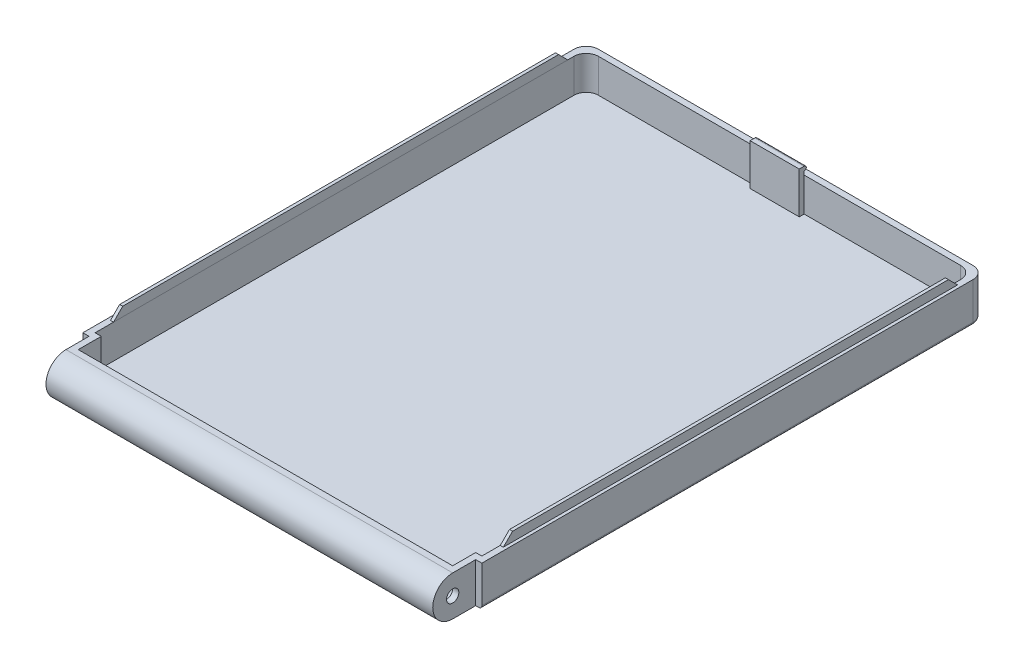
from build123d import *

# Parameters (mm, degrees)
SALIENTE_EXTRUIR1_DEPTH     = 13
CORTAR_EXTRUIR7_DEPTH       = 11
CORTAR_EXTRUIR9_DEPTH       = 140
CROQUIS10_R                 = 4.5
CORTAR_EXTRUIR10_DEPTH      = 122
CROQUIS11_W                 = 122
CROQUIS11_H                 = 12.524990812
CORTAR_EXTRUIR12_DEPTH      = 11
CORTAR_EXTRUIR13_DEPTH      = 130
CORTAR_EXTRUIR13_DEPTH_BACK = 130
CROQUIS12_R                 = 2
CROQUIS13_W                 = 16
CROQUIS13_H                 = 13.5
SALIENTE_EXTRUIR3_DEPTH     = 1.6
SALIENTE_EXTRUIR4_DEPTH     = 16
REDONDEO1_R                 = 1
SALIENTE_EXTRUIR5_DEPTH     = 1
SALIENTE_EXTRUIR6_DEPTH     = 1


with BuildPart() as part:
    # Croquis1 → Saliente-Extruir1 (new body)
    with BuildSketch(Plane(origin=(0, 0, 0), x_dir=(1, 0, 0), z_dir=(0, 1, 0))):
        with BuildLine():
            Line((130, 0), (128, 0))
            Line((128, 0), (128, -14))
            Line((128, -14), (2, -14))
            Line((2, -14), (2, 0))
            Line((2, 0), (0, 0))
            Line((0, 0), (0, 160))
            ThreePointArc((0, 160), (1.171572875, 162.828427125), (4, 164))
            Line((4, 164), (126, 164))
            ThreePointArc((126, 164), (128.828427125, 162.828427125), (130, 160))
            Line((130, 160), (130, 0))
        make_face()
    extrude(amount=SALIENTE_EXTRUIR1_DEPTH)

    # Croquis7 → Cortar-Extruir7 (cut)
    with BuildSketch(Plane(origin=(0, 13, 0), x_dir=(1, 0, 0), z_dir=(0, 1, 0))):
        with BuildLine():
            ThreePointArc((124, 162), (126.828427125, 160.828427125), (128, 158))
            Line((128, 158), (128, 2))
            Line((128, 2), (2, 2))
            Line((2, 2), (2, 158))
            ThreePointArc((2, 158), (3.171572875, 160.828427125), (6, 162))
            Line((6, 162), (62.001239157, 162))
            Line((62.001239157, 162), (124, 162))
        make_face()
    extrude(amount=-CORTAR_EXTRUIR7_DEPTH, mode=Mode.SUBTRACT)

    # Croquis8 → Cortar-Extruir9 (cut)
    with BuildSketch(Plane(origin=(128, 0, 0), x_dir=(0, 0, -1), z_dir=(1, 0, 0))):
        with BuildLine():
            ThreePointArc((-14, 6.5), (-12.096194078, 11.096194078), (-7.5, 13))
            Line((-7.5, 13), (-14, 13))
            Line((-14, 13), (-14, 6.5))
        make_face()
        with BuildLine():
            Line((-14, 0), (-7.5, 0))
            ThreePointArc((-7.5, 0), (-12.096194078, 1.903805922), (-14, 6.5))
            Line((-14, 6.5), (-14, 0))
        make_face()
    extrude(amount=-CORTAR_EXTRUIR9_DEPTH, mode=Mode.SUBTRACT)

    # Croquis10 → Cortar-Extruir10 (cut)
    with BuildSketch(Plane(origin=(4, 0, 0), x_dir=(0, 0, -1), z_dir=(1, 0, 0))):
        with Locations(Location((-7.5, 6.5, 0), (0, 0, 180))):
            Circle(CROQUIS10_R)
    extrude(amount=CORTAR_EXTRUIR10_DEPTH, mode=Mode.SUBTRACT)

    # Croquis11 → Cortar-Extruir12 (cut)
    with BuildSketch(Plane(origin=(0, 13, 0), x_dir=(1, 0, 0), z_dir=(0, 1, 0))):
        Polygon((4, 2), (4, -5.5), (6, -5.5), (126, -5.5), (126, 2), align=None)
        with Locations((65, 8.262495406)):
            Rectangle(CROQUIS11_W, CROQUIS11_H)
    extrude(amount=-CORTAR_EXTRUIR12_DEPTH, mode=Mode.SUBTRACT)

    # Croquis12 → Cortar-Extruir13 (cut, two sides: drawn at the far end of the back side and taken through both)
    with BuildSketch(Plane(origin=(4, 0, 0), x_dir=(0, 0, -1), z_dir=(1, 0, 0)).offset(-CORTAR_EXTRUIR13_DEPTH_BACK)):
        with Locations((-7.5, 6.5)):
            Circle(CROQUIS12_R)
    extrude(amount=CORTAR_EXTRUIR13_DEPTH + CORTAR_EXTRUIR13_DEPTH_BACK, mode=Mode.SUBTRACT)

    # Redondeo1
    redondeo1_edges = [part.edges().sort_by_distance(p)[0] for p in [
        (128.828427125, 0, -162.828427125),
        (130, 0, -80),
        (0, 0, -80),
        (1.171572875, 0, -162.828427125),
        (65, 0, -164),
    ]]
    fillet(redondeo1_edges, radius=REDONDEO1_R)

    # Croquis16 → Saliente-Extruir6 (add)
    with BuildSketch(Plane(origin=(128, 0, 0), x_dir=(0, 0, -1), z_dir=(1, 0, 0))):
        Polygon((156, 13), (153, 16), (11, 16), (8, 13), align=None)
    extrude(amount=SALIENTE_EXTRUIR6_DEPTH)


with BuildPart() as body_2:
    # Croquis13 → Saliente-Extruir3 (new body)
    with BuildSketch(Plane.XY.offset(-162)):
        with Locations((65, 8.75)):
            Rectangle(CROQUIS13_W, CROQUIS13_H)
    extrude(amount=SALIENTE_EXTRUIR3_DEPTH)

    # Croquis14 → Saliente-Extruir4 (add)
    with BuildSketch(Plane(origin=(73, 0, 0), x_dir=(0, 0, -1), z_dir=(1, 0, 0))):
        with BuildLine():
            Line((162, 14.095856006), (161.923719179, 15.5))
            ThreePointArc((161.923719179, 15.5), (162.703107232, 14.83819665), (162, 14.095856006))
        make_face()
    extrude(amount=-SALIENTE_EXTRUIR4_DEPTH)


with BuildPart() as body_3:
    # Croquis15 → Saliente-Extruir5 (new body)
    with BuildSketch(Plane(origin=(2, 0, 0), x_dir=(0, 0, -1), z_dir=(1, 0, 0))):
        Polygon((153, 16), (11, 16), (8, 13), (156, 13), align=None)
    extrude(amount=-SALIENTE_EXTRUIR5_DEPTH)


solid = Compound([part.part, body_2.part, body_3.part])
